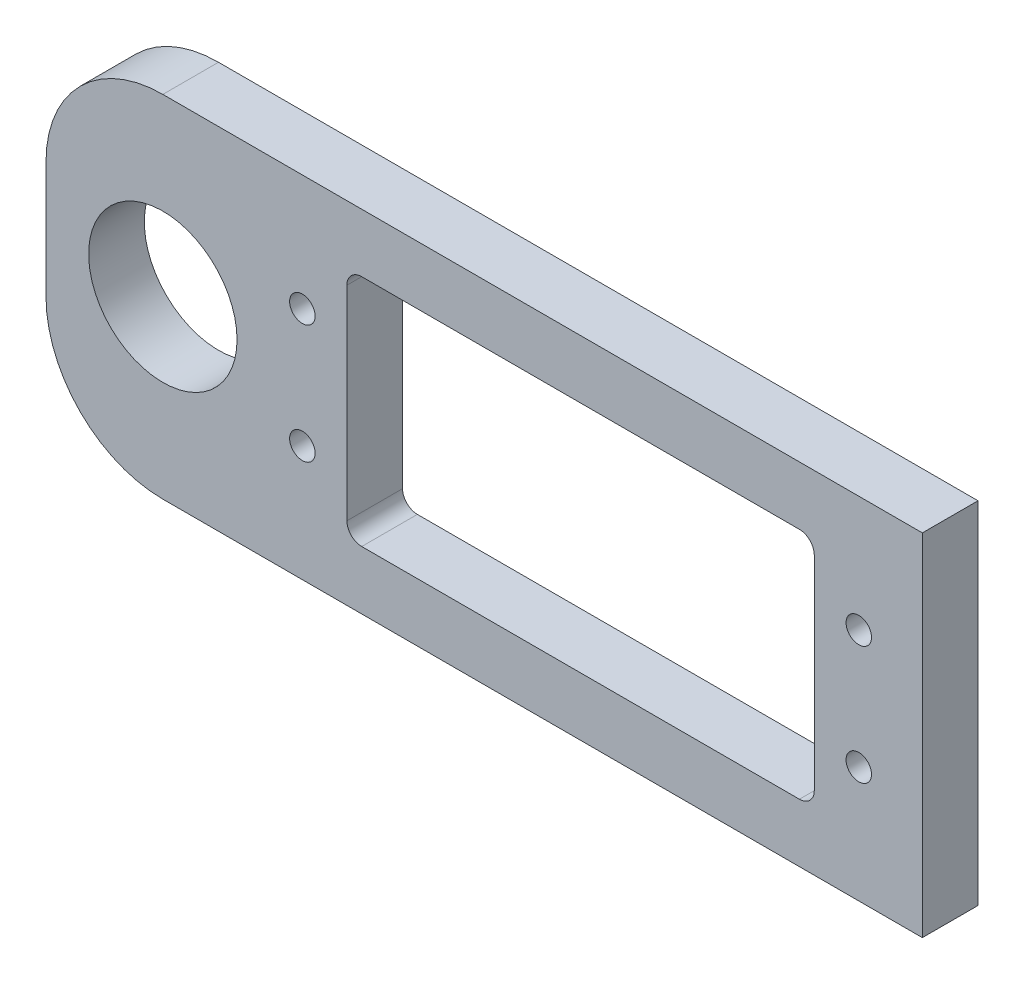
from build123d import *

# Parameters (mm, degrees)
ESQUISSE1_W             = 75
ESQUISSE1_H             = 30
BOSS_EXTRU_1_DEPTH      = 4.7625
CONG_1_R                = 10
ESQUISSE2_R             = 6.35
ENL_V_MAT_EXTRU_1_DEPTH = 6
ENL_V_MAT_EXTRU_2_REACH = 42.669
ESQUISSE3_W             = 40
ESQUISSE3_H             = 20
CONG_2_R                = 1.27
ENL_V_MAT_EXTRU_3_REACH = 42.669
ESQUISSE4_R             = 1.09


with BuildPart() as part:
    # Esquisse1 → Boss.-Extru.1 (new body)
    with BuildSketch(Plane.XY):
        Rectangle(ESQUISSE1_W, ESQUISSE1_H)
    extrude(amount=BOSS_EXTRU_1_DEPTH)

    # Congé1
    cong_1_edges = [part.edges().sort_by_distance(p)[0] for p in [
        (-37.5, -15, 2.38125),
        (-37.5, 15, 2.38125),
    ]]
    fillet(cong_1_edges, radius=CONG_1_R)

    # Esquisse2 → Enlèv. mat.-Extru.1 (cut)
    with BuildSketch(Plane.XY.offset(4.7625)):
        with Locations((-27.5, 0)):
            Circle(ESQUISSE2_R)
    extrude(amount=-ENL_V_MAT_EXTRU_1_DEPTH, mode=Mode.SUBTRACT)

    # Esquisse3 → Enlèv. mat.-Extru.2 (cut, up to next)
    with BuildSketch(Plane.XY.offset(4.7625), mode=Mode.PRIVATE) as enl_v_mat_extru_2_sk1:
        with Locations((8.25, 0)):
            Rectangle(ESQUISSE3_W, ESQUISSE3_H)
    enl_v_mat_extru_2_tool1 = extrude(enl_v_mat_extru_2_sk1.sketch, amount=-ENL_V_MAT_EXTRU_2_REACH, mode=Mode.PRIVATE) & part.part
    add(enl_v_mat_extru_2_tool1.solids().sort_by_distance((8.25, 0, 4.7625))[0], mode=Mode.SUBTRACT)

    # Congé2
    cong_2_edges = [part.edges().sort_by_distance(p)[0] for p in [
        (-11.75, -10, 2.38125),
        (-11.75, 10, 2.38125),
        (28.25, 10, 2.38125),
        (28.25, -10, 2.38125),
    ]]
    fillet(cong_2_edges, radius=CONG_2_R)

    # Esquisse4 → Enlèv. mat.-Extru.3 (cut, up to next)
    with BuildSketch(Plane.XY.offset(4.7625), mode=Mode.PRIVATE) as enl_v_mat_extru_3_sk1:
        with Locations((-15.56, 5.08)):
            Circle(ESQUISSE4_R)
    enl_v_mat_extru_3_tool1 = extrude(enl_v_mat_extru_3_sk1.sketch, amount=-ENL_V_MAT_EXTRU_3_REACH, mode=Mode.PRIVATE) & part.part
    # Esquisse4 → Enlèv. mat.-Extru.3 (cut, up to next)
    with BuildSketch(Plane.XY.offset(4.7625), mode=Mode.PRIVATE) as enl_v_mat_extru_3_sk2:
        with Locations((-15.56, -5.08)):
            Circle(ESQUISSE4_R)
    enl_v_mat_extru_3_tool2 = extrude(enl_v_mat_extru_3_sk2.sketch, amount=-ENL_V_MAT_EXTRU_3_REACH, mode=Mode.PRIVATE) & part.part
    # Esquisse4 → Enlèv. mat.-Extru.3 (cut, up to next)
    with BuildSketch(Plane.XY.offset(4.7625), mode=Mode.PRIVATE) as enl_v_mat_extru_3_sk3:
        with Locations((32.06, -5.08)):
            Circle(ESQUISSE4_R)
    enl_v_mat_extru_3_tool3 = extrude(enl_v_mat_extru_3_sk3.sketch, amount=-ENL_V_MAT_EXTRU_3_REACH, mode=Mode.PRIVATE) & part.part
    # Esquisse4 → Enlèv. mat.-Extru.3 (cut, up to next)
    with BuildSketch(Plane.XY.offset(4.7625), mode=Mode.PRIVATE) as enl_v_mat_extru_3_sk4:
        with Locations((32.06, 5.08)):
            Circle(ESQUISSE4_R)
    enl_v_mat_extru_3_tool4 = extrude(enl_v_mat_extru_3_sk4.sketch, amount=-ENL_V_MAT_EXTRU_3_REACH, mode=Mode.PRIVATE) & part.part
    add(enl_v_mat_extru_3_tool1.solids().sort_by_distance((-15.56, 5.08, 4.7625))[0], mode=Mode.SUBTRACT)
    add(enl_v_mat_extru_3_tool2.solids().sort_by_distance((-15.56, -5.08, 4.7625))[0], mode=Mode.SUBTRACT)
    add(enl_v_mat_extru_3_tool3.solids().sort_by_distance((32.06, -5.08, 4.7625))[0], mode=Mode.SUBTRACT)
    add(enl_v_mat_extru_3_tool4.solids().sort_by_distance((32.06, 5.08, 4.7625))[0], mode=Mode.SUBTRACT)


solid = part.part
